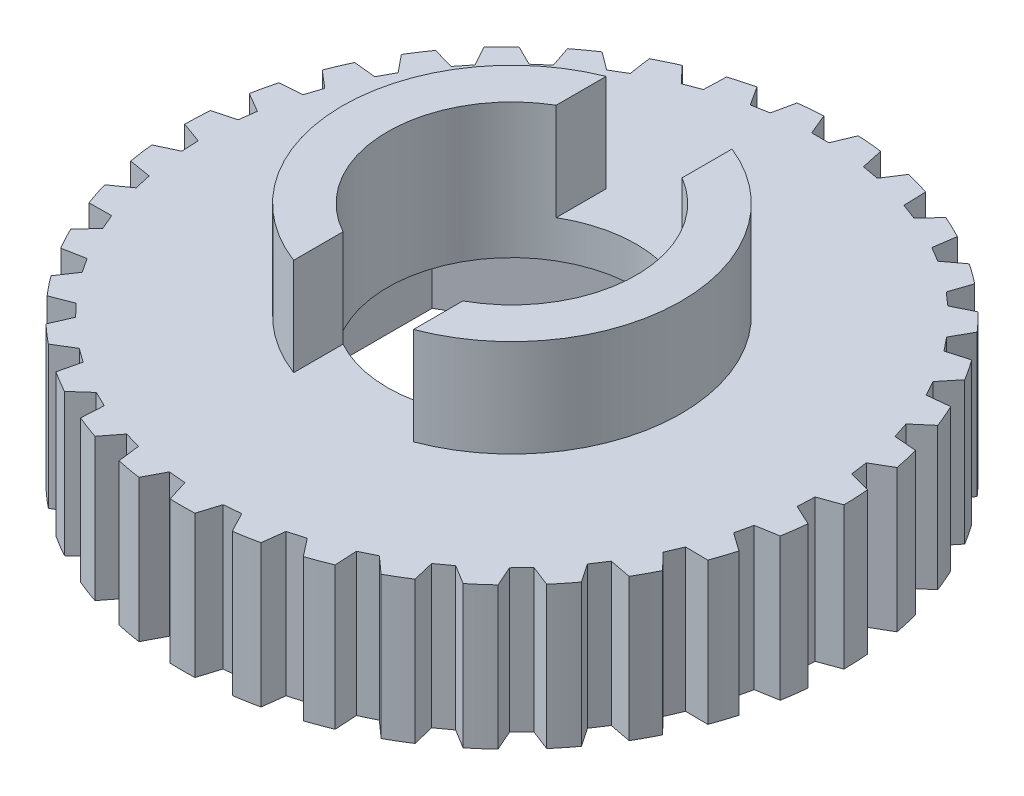
from build123d import *

# Parameters (mm, degrees)
SKETCH_1_R               = 5.65
SKETCH_1_R_2             = 4.15
EXTRUDE_1_DEPTH          = 8
SKETCH_1_3_R             = 11
SKETCH_1_3_R_2           = 5.65
EXTRUDE_2_DEPTH          = 4.75
CUT_EXTRUDE_1_DEPTH      = 3.5
CUT_EXTRUDE_START        = -3.25
CUT_EXTRUDE_3_DEPTH      = 3.25
CUT_EXTRUDE_START_2      = -10
CUT_EXTRUDE_4_DEPTH      = 10
PATTERN_CIRCULAR_1_COUNT = 35


with BuildPart() as part:
    # 草图1 → 凸台-拉伸1 (new body)
    with BuildSketch(Plane(origin=(0, 0, 0), x_dir=(1, 0, 0), z_dir=(0, 1, 0))):
        with Locations(Location((0, 0, 0), (0, 0, 270))):
            Circle(SKETCH_1_R)
        with Locations(Location((0, 0, 0), (0, 0, 270))):
            Circle(SKETCH_1_R_2, mode=Mode.SUBTRACT)
    extrude(amount=EXTRUDE_1_DEPTH)

    # 草图1<3> → 凸台-拉伸2 (add)
    with BuildSketch(Plane(origin=(0, 0, 0), x_dir=(1, 0, 0), z_dir=(0, 1, 0))):
        with Locations(Location((0, 0, 0), (0, 0, 270))):
            Circle(SKETCH_1_3_R)
        with Locations(Location((0, 0, 0), (0, 0, 270))):
            Circle(SKETCH_1_3_R_2, mode=Mode.SUBTRACT)
    extrude(amount=EXTRUDE_2_DEPTH)

    # 草图2 → 切除-拉伸1 (cut)
    with BuildSketch(Plane.XZ):
        Polygon((0, -7.274613392), (-6.3, -3.637306696), (-6.3, 3.637306696), (0, 7.274613392), (6.3, 3.637306696), (6.3, -3.637306696), align=None)
    extrude(amount=-CUT_EXTRUDE_1_DEPTH, mode=Mode.SUBTRACT)

    # 草图4 → 切除-拉伸3 (cut)
    with BuildSketch(Plane(origin=(0, 8, 0), x_dir=(1, 0, 0), z_dir=(0, 1, 0)).offset(CUT_EXTRUDE_START)):
        with BuildLine():
            Line((-2.1, 5.245235934), (-2.1, 3.579455266))
            ThreePointArc((-2.1, 3.579455266), (0, 4.15), (2.1, 3.579455266))
            Line((2.1, 3.579455266), (2.1, 5.245235934))
            ThreePointArc((2.1, 5.245235934), (0, 5.65), (-2.1, 5.245235934))
        make_face()
        with BuildLine():
            Line((2, -3.636275567), (2, -5.284174486))
            ThreePointArc((2, -5.284174486), (0, -5.65), (-2, -5.284174486))
            Line((-2, -5.284174486), (-2, -3.636275567))
            ThreePointArc((-2, -3.636275567), (0, -4.15), (2, -3.636275567))
        make_face()
    extrude(amount=CUT_EXTRUDE_3_DEPTH, mode=Mode.SUBTRACT)

    # 草图5 → 切除-拉伸4 (cut)
    with BuildSketch(Plane(origin=(0, 4.75, 0), x_dir=(1, 0, 0), z_dir=(0, 1, 0)).offset(CUT_EXTRUDE_START_2)):
        with BuildLine():
            ThreePointArc((0.574025149, 10.985012295), (0, 11), (-0.574025149, 10.985012295))
            Line((-0.574025149, 10.985012295), (-0.287012574, 10.292102646))
            Line((-0.287012574, 10.292102646), (0.287012574, 10.292102646))
            Line((0.287012574, 10.292102646), (0.574025149, 10.985012295))
        make_face()
    cut_extrude_4 = extrude(amount=CUT_EXTRUDE_4_DEPTH, mode=Mode.SUBTRACT)

    # 阵列(圆周)1: 切除-拉伸4 ×35 about axis
    pattern_circular_1_axis = Axis((0, 0, 0), (0, 1, 0))
    for i in range(1, PATTERN_CIRCULAR_1_COUNT):
        add(cut_extrude_4.rotate(pattern_circular_1_axis, i * 360 / PATTERN_CIRCULAR_1_COUNT), mode=Mode.SUBTRACT)


solid = part.part
